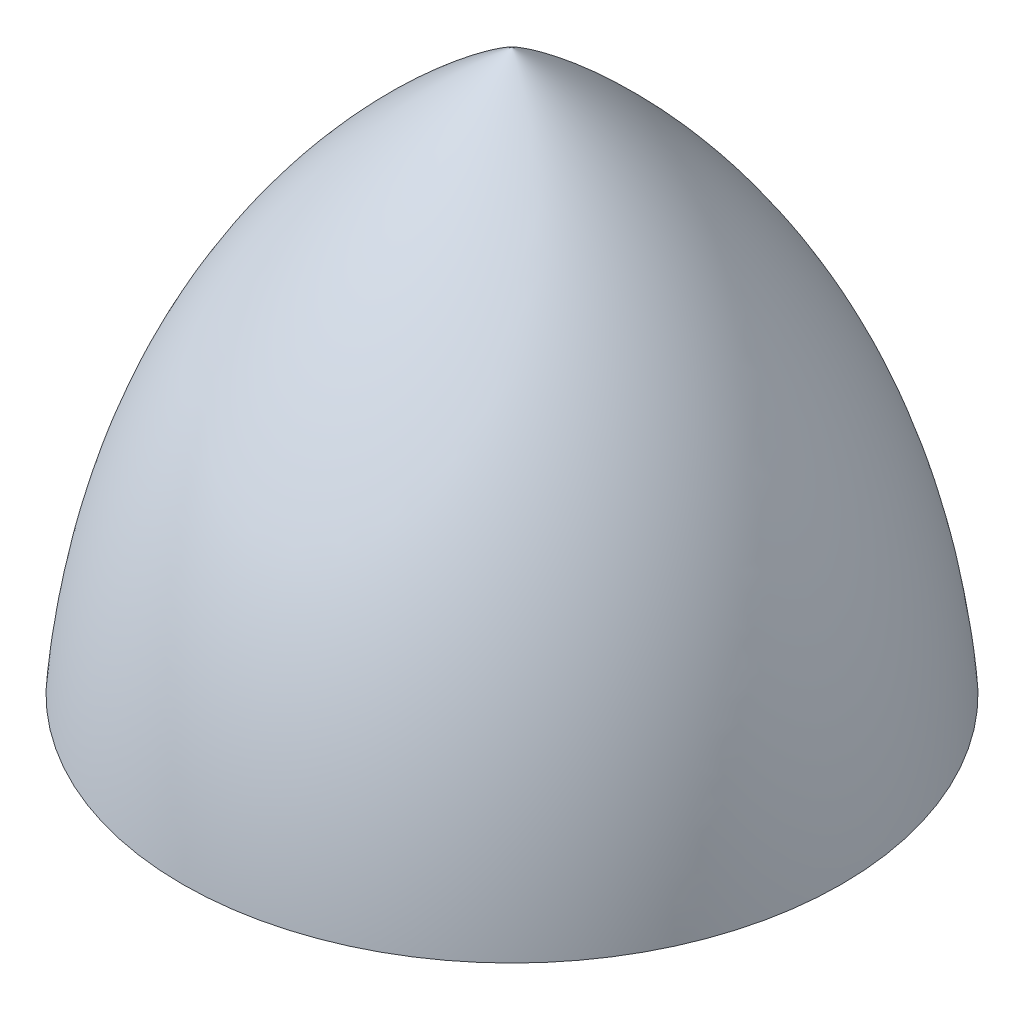
from build123d import *


with BuildPart() as part:
    # Sketch1 → Revolve1 (revolve)
    with BuildSketch(Plane.XY):
        with BuildLine():
            Line((400, 0), (500, 0))
            add(Edge.make_bspline(
                [(0, 850), (452.228611773, 543.916759888), (500, 0)],
                knots=[0, 0, 0, 1, 1, 1], degree=2))
            Line((0, 850), (0, 750))
            add(Edge.make_bspline(
                [(0, 750), (357.710489503, 458.385199362), (400, 0)],
                knots=[0, 0, 0, 1, 1, 1], degree=2))
        make_face()
    revolve(axis=Axis((0, 286.878092342, 0), (0, -1, 0)))


solid = part.part
